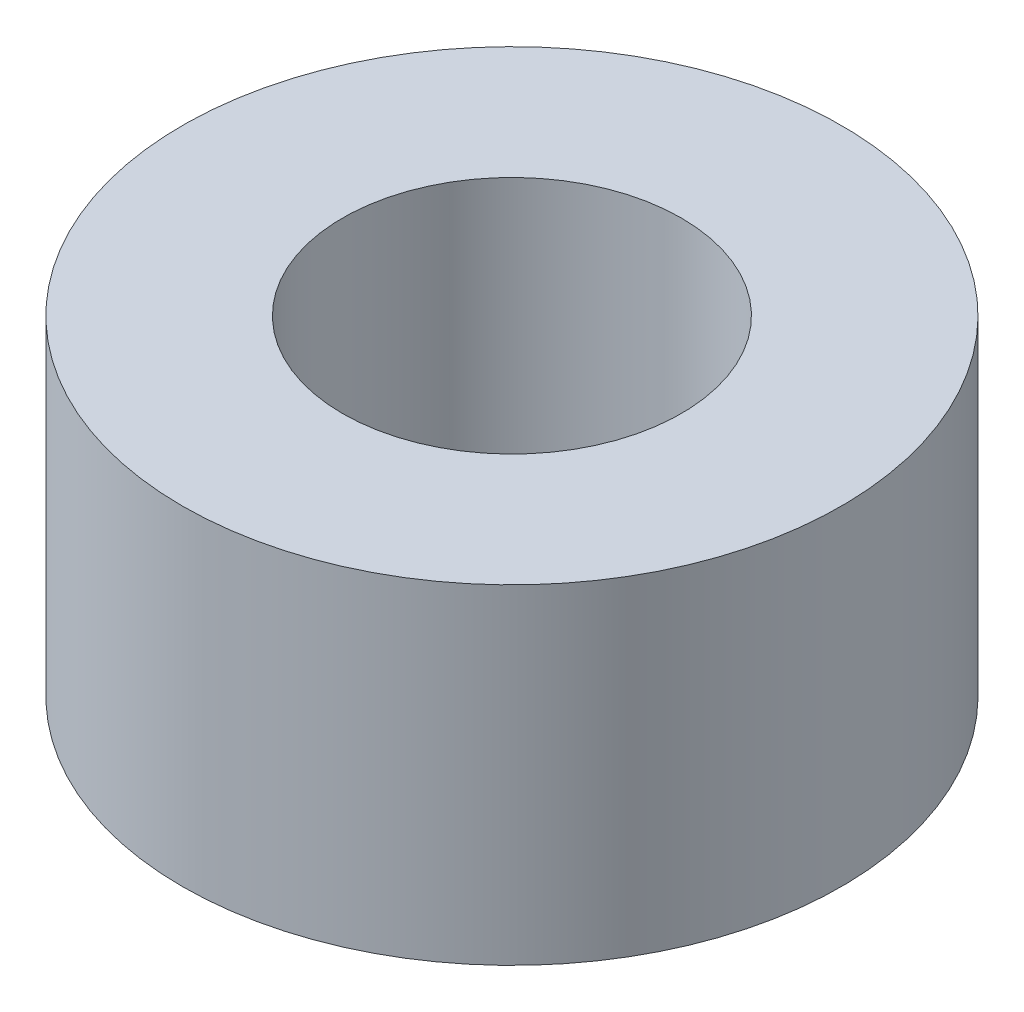
from build123d import *

# Parameters (mm, degrees)
SKETCH1_R           = 6.35
SKETCH1_R_2         = 3.2639
BOSS_EXTRUDE1_DEPTH = 6.35


with BuildPart() as part:
    # Sketch1 → Boss-Extrude1 (new body)
    with BuildSketch(Plane(origin=(0, 0, 0), x_dir=(1, 0, 0), z_dir=(0, 1, 0))):
        with Locations(Location((0, 0, 0), (0, 0, 270))):
            Circle(SKETCH1_R)
        with Locations(Location((0, 0, 0), (0, 0, 270))):
            Circle(SKETCH1_R_2, mode=Mode.SUBTRACT)
    extrude(amount=BOSS_EXTRUDE1_DEPTH)


solid = part.part
